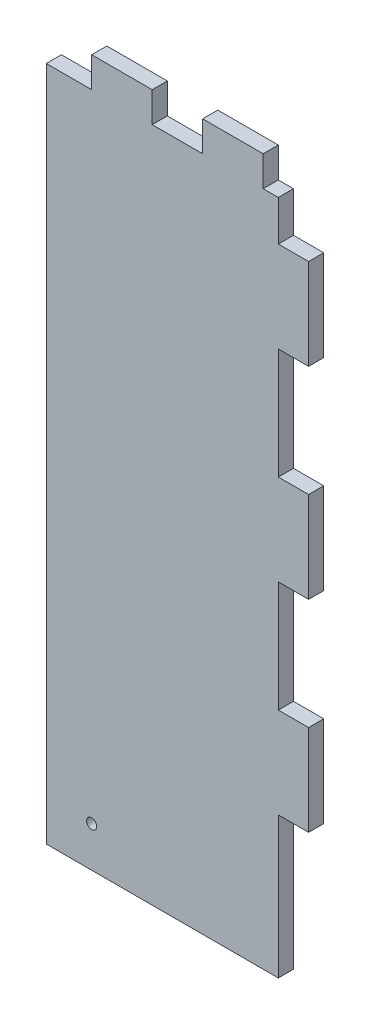
from build123d import *

# Parameters (mm, degrees)
ESQUISSE1_W             = 52
ESQUISSE1_H             = 140
BOSS_EXTRU_1_DEPTH      = 3
ESQUISSE2_R             = 1
ESQUISSE2_W             = 9
ESQUISSE2_H             = 6
ESQUISSE2_W_2           = 10
ESQUISSE2_W_3           = 6
ESQUISSE2_H_2           = 22
ESQUISSE2_H_3           = 27.999999716
ENL_V_MAT_EXTRU_1_DEPTH = 108.616004474


with BuildPart() as part:
    # Esquisse1 → Boss.-Extru.1 (new body)
    with BuildSketch(Plane.XY):
        with Locations((20.753246753, 26.883116883)):
            Rectangle(ESQUISSE1_W, ESQUISSE1_H)
    extrude(amount=BOSS_EXTRU_1_DEPTH)

    # Esquisse2 → Enlèv. mat.-Extru.1 (cut, through all)
    with BuildSketch(Plane.XY.offset(3)):
        with Locations((3.753246753, -35.116883117)):
            Circle(ESQUISSE2_R)
        with Locations((-0.746753247, 93.883116883)):
            Rectangle(ESQUISSE2_W, ESQUISSE2_H)
        with Locations((20.753246753, 93.883116883)):
            Rectangle(ESQUISSE2_W_2, ESQUISSE2_H)
        Polygon((37.753246753, 96.883116883), (37.753246753, 90.883116883), (40.753246753, 90.883116883), (40.753246753, 82.883116599), (46.753246753, 82.883116599), (46.753246753, 96.883116883), align=None)
        with Locations((43.753246753, 53.883116599)):
            Rectangle(ESQUISSE2_W_3, ESQUISSE2_H_2)
        with Locations((43.753246753, 13.883116599)):
            Rectangle(ESQUISSE2_W_3, ESQUISSE2_H_2)
        with Locations((43.753246753, -29.116883259)):
            Rectangle(ESQUISSE2_W_3, ESQUISSE2_H_3)
    extrude(amount=-ENL_V_MAT_EXTRU_1_DEPTH, mode=Mode.SUBTRACT)


solid = part.part
